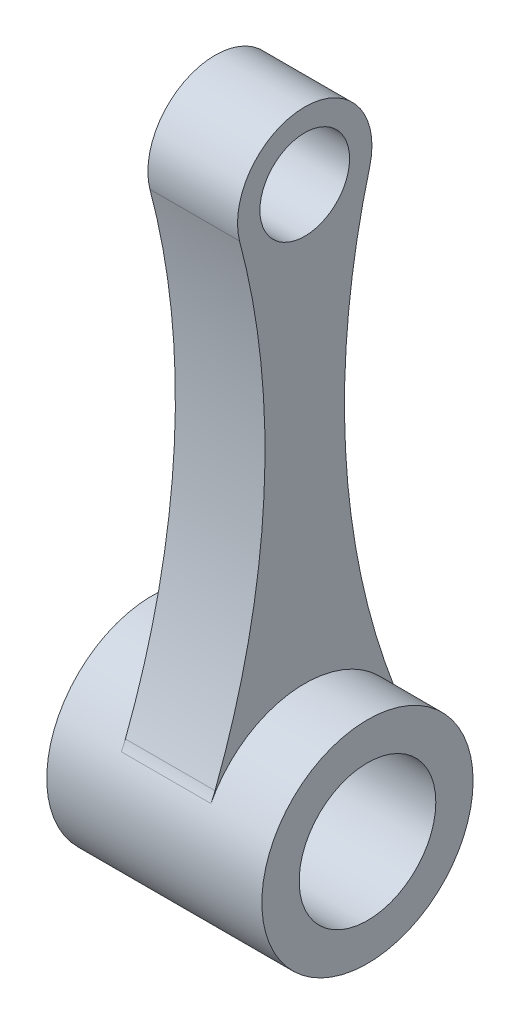
from build123d import *

# Parameters (mm, degrees)
BOSS_EXTRUDE2_DEPTH      = 12
BOSS_EXTRUDE2_DEPTH_BACK = 12
SKETCH1_R                = 7.625
SKETCH1_R_2              = 5
FILLET1_R                = 10
CUT_EXTRUDE1_START       = -7
SKETCH2_R                = 5
CUT_EXTRUDE1_DEPTH       = 7
SKETCH3_R                = 5
CUT_EXTRUDE2_DEPTH       = 7


with BuildPart() as part:
    # Sketch1 → Boss-Extrude2 (new, two sides: drawn at the far end of the back side and taken through both)
    with BuildSketch(Plane(origin=(0, 0, 0), x_dir=(0, 0, -1), z_dir=(1, 0, 0)).offset(-BOSS_EXTRUDE2_DEPTH_BACK)):
        with BuildLine():
            ThreePointArc((10.249331942, 5.817161927), (4.569540082, 31.759611334), (7.275406493, 58.178335825))
            ThreePointArc((7.275406493, 58.178335825), (0, 67.5), (-7.275406493, 58.178335825))
            ThreePointArc((-7.275406493, 58.178335825), (-4.569540082, 31.759611334), (-10.249331942, 5.817161927))
            ThreePointArc((-10.249331942, 5.817161927), (0, -11.785082866), (10.249331942, 5.817161927))
        make_face()
        Circle(SKETCH1_R, mode=Mode.SUBTRACT)
        with Locations((0, 60)):
            Circle(SKETCH1_R_2, mode=Mode.SUBTRACT)
    extrude(amount=BOSS_EXTRUDE2_DEPTH + BOSS_EXTRUDE2_DEPTH_BACK)

    # Fillet1
    fillet1_edges = [part.edges().sort_by_distance(p)[0] for p in [
        (0, 5.817161927, -10.249331942),
        (0, 5.817161927, 10.249331942),
    ]]
    fillet(fillet1_edges, radius=FILLET1_R)

    # Sketch2 → Cut-Extrude1 (cut)
    with BuildSketch(Plane(origin=(12, 0, 0), x_dir=(0, 0, -1), z_dir=(1, 0, 0)).offset(CUT_EXTRUDE1_START)):
        with BuildLine():
            ThreePointArc((7.275406493, 58.178335825), (0, 67.5), (-7.275406493, 58.178335825))
            ThreePointArc((-7.275406493, 58.178335825), (-4.551513528, 32.088385289), (-10.010939305, 6.431031917))
            ThreePointArc((-10.010939305, 6.431031917), (-10.224413054, 5.917964178), (-10.466057682, 5.417546931))
            ThreePointArc((-10.466057682, 5.417546931), (0, 11.785082866), (10.466057682, 5.417546931))
            ThreePointArc((10.466057682, 5.417546931), (10.224413054, 5.917964178), (10.010939305, 6.431031917))
            ThreePointArc((10.010939305, 6.431031917), (4.551513528, 32.088385289), (7.275406493, 58.178335825))
        make_face()
        with Locations((0, 60)):
            Circle(SKETCH2_R, mode=Mode.SUBTRACT)
    extrude(amount=CUT_EXTRUDE1_DEPTH, mode=Mode.SUBTRACT)

    # Sketch3 → Cut-Extrude2 (cut)
    with BuildSketch(Plane.ZY.offset(12)):
        with BuildLine():
            ThreePointArc((7.275406493, 58.178335825), (0, 67.5), (-7.275406493, 58.178335825))
            ThreePointArc((-7.275406493, 58.178335825), (-4.551513528, 32.088385289), (-10.010939305, 6.431031917))
            ThreePointArc((-10.010939305, 6.431031917), (-10.224413054, 5.917964178), (-10.466057682, 5.417546931))
            ThreePointArc((-10.466057682, 5.417546931), (0, 11.785082866), (10.466057682, 5.417546931))
            ThreePointArc((10.466057682, 5.417546931), (10.224413054, 5.917964178), (10.010939305, 6.431031917))
            ThreePointArc((10.010939305, 6.431031917), (4.551513528, 32.088385289), (7.275406493, 58.178335825))
        make_face()
        with Locations((0, 60)):
            Circle(SKETCH3_R, mode=Mode.SUBTRACT)
    extrude(amount=-CUT_EXTRUDE2_DEPTH, mode=Mode.SUBTRACT)


solid = part.part
